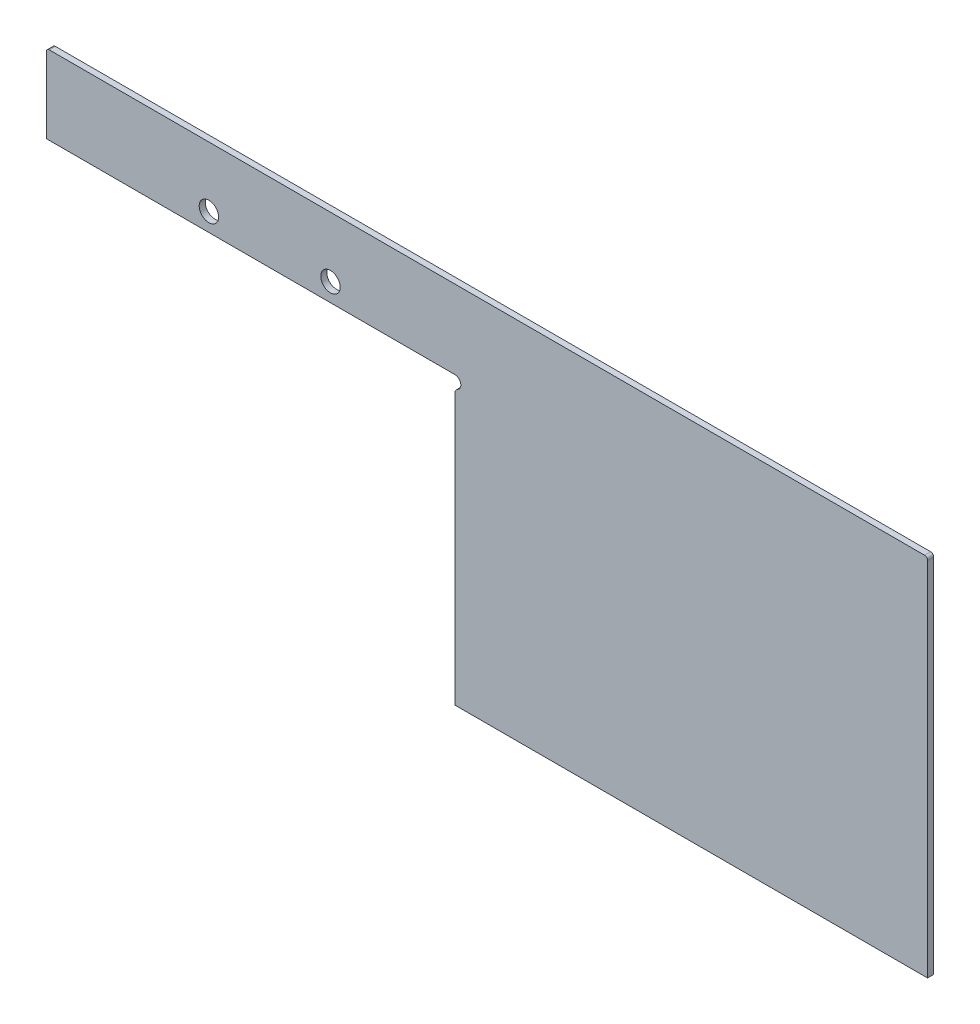
from build123d import *

# Parameters (mm, degrees)
SKETCH_1_R          = 1.6
EXTRUDE_1_DEPTH     = 1
SKETCH_2_R          = 1
CUT_EXTRUDE_1_DEPTH = 10
FILLET_1_R          = 1
SKETCH_3_W          = 0.5
SKETCH_3_H          = 12.9
SKETCH_3_H_2        = 60
CUT_EXTRUDE_2_DEPTH = 154.412548379
FILLET_2_R          = 0.5


with BuildPart() as part:
    # 草图1 → 凸台-拉伸1 (new body)
    with BuildSketch(Plane.XY):
        Polygon((0, 0), (0, 12.9), (146, 12.9), (146, -47.1), (67.7, -47.1), (67.7, 0), align=None)
        with Locations(Location((47.25, 3, 0), (0, 0, 180))):
            Circle(SKETCH_1_R, mode=Mode.SUBTRACT)
        with Locations(Location((27.25, 3, 0), (0, 0, 180))):
            Circle(SKETCH_1_R, mode=Mode.SUBTRACT)
    extrude(amount=EXTRUDE_1_DEPTH)

    # 草图2 → 切除-拉伸1 (cut)
    with BuildSketch(Plane.XY.offset(1)):
        with Locations((67.7, -1)):
            Circle(SKETCH_2_R)
    extrude(amount=-CUT_EXTRUDE_1_DEPTH, mode=Mode.SUBTRACT)

    # 圆角1
    fillet_1_edges = [part.edges().sort_by_distance(p)[0] for p in [
        (67.7, -2, 0.5),
    ]]
    fillet(fillet_1_edges, radius=FILLET_1_R)

    # 草图3 → 切除-拉伸2 (cut, through all)
    with BuildSketch(Plane.XY.offset(1)):
        with Locations((0.25, 6.45)):
            Rectangle(SKETCH_3_W, SKETCH_3_H)
        with Locations((145.75, -17.1)):
            Rectangle(SKETCH_3_W, SKETCH_3_H_2)
    extrude(amount=-CUT_EXTRUDE_2_DEPTH, mode=Mode.SUBTRACT)

    # 圆角2
    fillet_2_edges = [part.edges().sort_by_distance(p)[0] for p in [
        (0.5, 12.9, 0.5),
        (145.5, 12.9, 0.5),
    ]]
    fillet(fillet_2_edges, radius=FILLET_2_R)


solid = part.part
